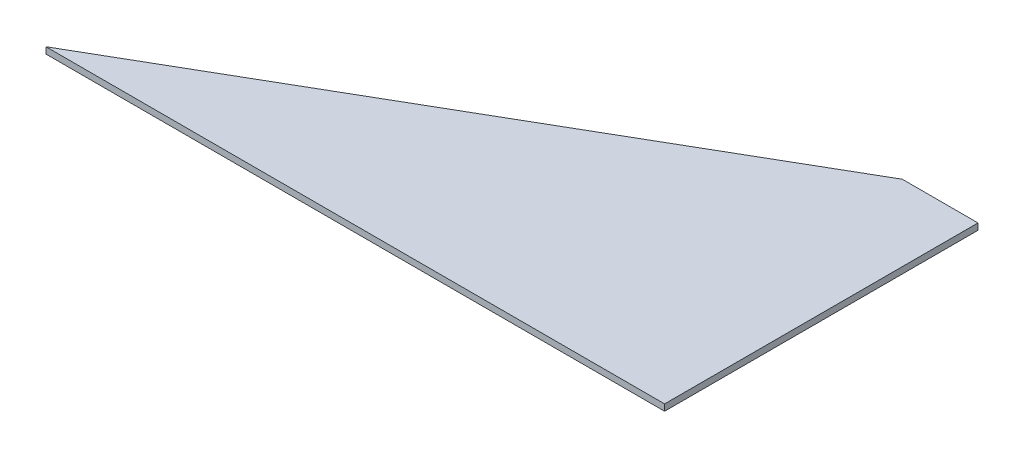
from build123d import *

# Parameters (mm, degrees)
BOSS_EXTRUDE1_DEPTH = 3.937


with BuildPart() as part:
    # Sketch1 → Boss-Extrude1 (new body)
    with BuildSketch(Plane(origin=(0, 0, 0), x_dir=(1, 0, 0), z_dir=(0, 1, 0))):
        Polygon((0, 0), (381, 0), (381, 193.04), (334.355087893, 193.04), align=None)
    extrude(amount=BOSS_EXTRUDE1_DEPTH)


solid = part.part
